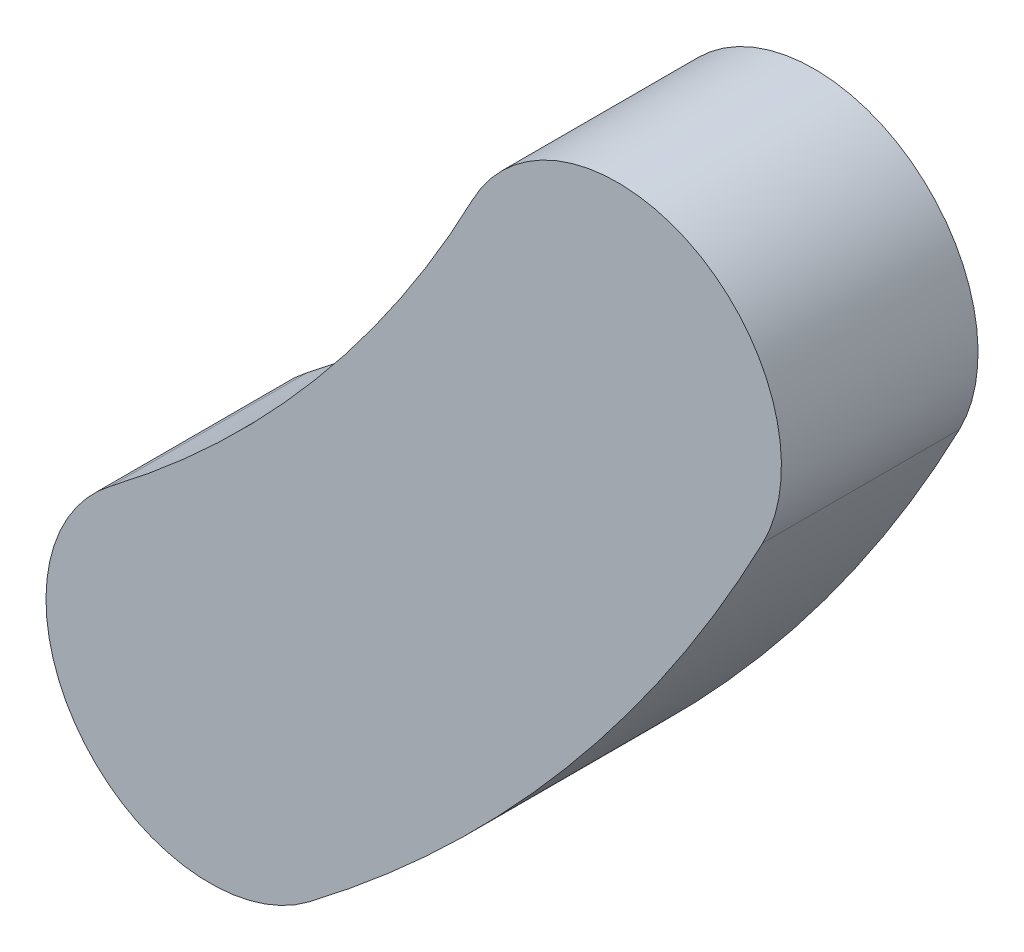
from build123d import *

# Parameters (mm, degrees)
BOSS_EXTRUDE1_DEPTH = 3


with BuildPart() as part:
    # Sketch2 → Boss-Extrude1 (new body)
    with BuildSketch(Plane(origin=(37.180630826, 0, 0), x_dir=(1, 0, 0), z_dir=(0, 0, 1))):
        with BuildLine():
            ThreePointArc((24.739904374, -3.980203127), (28.654692619, -0.260021328), (31.664127894, 4.224242151))
            ThreePointArc((31.664127894, 4.224242151), (30.605028558, 7.597416501), (27.231854208, 6.538317165))
            ThreePointArc((27.231854208, 6.538317165), (24.833631213, 2.964801602), (21.713931225, 0.000183752))
            ThreePointArc((21.713931225, 0.000183752), (21.23672436, -3.502996262), (24.739904374, -3.980203127))
        make_face()
    extrude(amount=BOSS_EXTRUDE1_DEPTH)


solid = part.part
